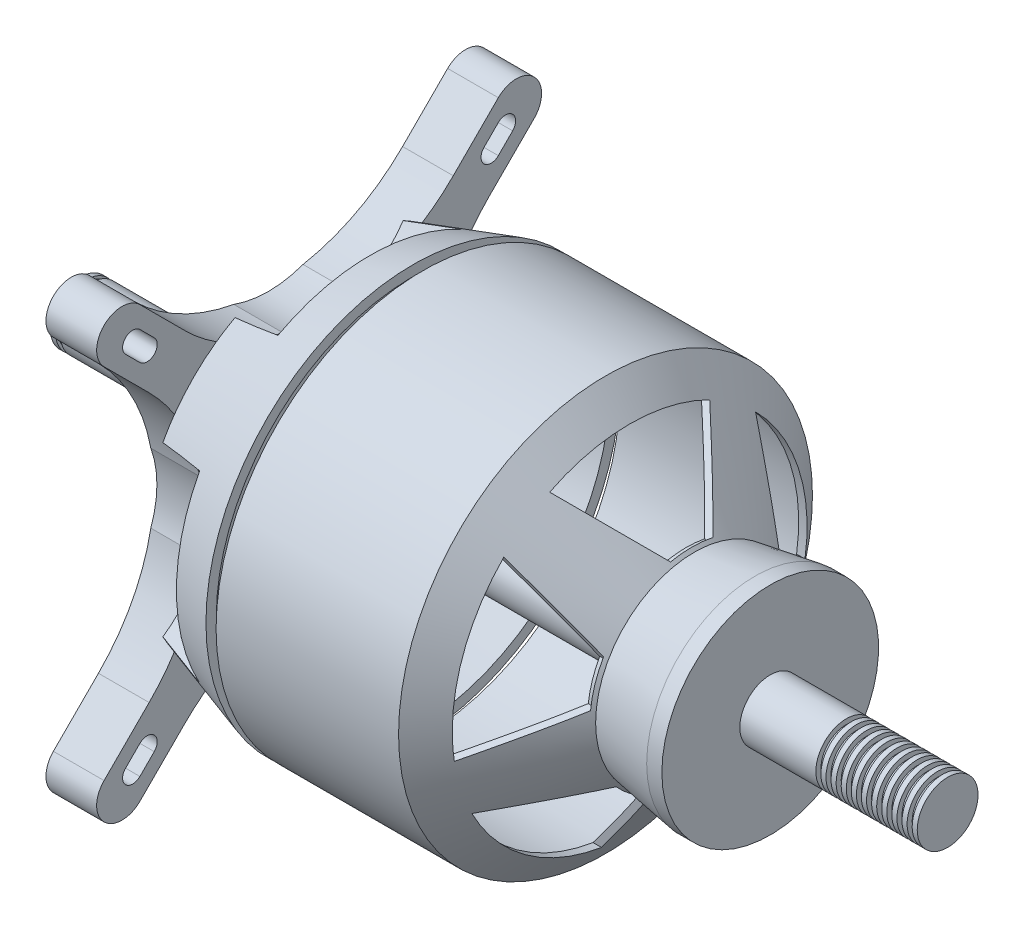
from build123d import *

# Parameters (mm, degrees)
SKETCH5_R           = 20
CUT_EXTRUDE1_DEPTH  = 10
CIRPATTERN2_COUNT   = 4
SKETCH6_R           = 6
BOSS_EXTRUDE3_DEPTH = 10
CUT_EXTRUDE2_DEPTH  = 10
CIRPATTERN3_COUNT   = 4
SKETCH8_R           = 2
CUT_EXTRUDE3_DEPTH  = 20
CIRPATTERN4_COUNT   = 4
CUT_EXTRUDE4_DEPTH  = 53
CIRPATTERN5_COUNT   = 5
SKETCH10_R          = 2.5
CUT_EXTRUDE5_DEPTH  = 20
CIRPATTERN6_COUNT   = 4


with BuildPart() as part:
    # Sketch1 → Revolve1 (revolve)
    with BuildSketch(Plane.XY, mode=Mode.PRIVATE) as revolve1_sk:
        Polygon((47, 6), (136, 6), (151, 6), (151, 5), (152, 5), (152, 6), (153, 6), (153, 5), (154, 5), (154, 6), (155, 6), (155, 5), (156, 5), (156, 6), (157, 6), (157, 5), (158, 5), (158, 6), (159, 6), (159, 5), (160, 5), (160, 6), (161, 6), (161, 5), (162, 5), (162, 6), (163, 6), (163, 5), (164, 5), (164, 6), (165, 6), (165, 5), (166, 5), (166, 6), (167, 6), (167, 5), (168, 5), (168, 6), (169, 6), (169, 5), (170, 5), (170, 6), (171, 6), (171, 0), (0, 0), (0, 6), (1, 6), (1, 5.5), (2, 5.5), (2, 6), align=None)
        Polygon((47, 35), (47, 6), (49.655465916, 6), (49.655465916, 33.855037011), (53.332972446, 35), (65.5, 38.788109179), (65.5, 38.83), (65.5, 40.83), align=None)
        Polygon((133, 19.45), (133, 6), (136, 6), (136, 21.38), (133, 21.38), (121, 19.45), (103.5, 40.83), (67.5, 40.83), (67.5, 38.83), (67.5, 38.788109179), (103.5, 38.788109179), (121, 17.497281901), align=None)
    revolve(revolve1_sk.sketch.rotate(Axis((0, 0, 0), (1, 0, 0)), 90), axis=Axis((0, 0, 0), (1, 0, 0)))

    # Sketch5 → Cut-Extrude1 (cut)
    with BuildSketch(Plane.ZY.offset(-47)):
        with Locations((0, 42)):
            Circle(SKETCH5_R)
    cut_extrude1 = extrude(amount=-CUT_EXTRUDE1_DEPTH, mode=Mode.SUBTRACT)

    # CirPattern2: Cut-Extrude1 ×4 about axis
    cirpattern2_axis = Axis((0, 0, 0), (1, 0, 0))
    for i in range(1, CIRPATTERN2_COUNT):
        add(cut_extrude1.rotate(cirpattern2_axis, i * 360 / CIRPATTERN2_COUNT), mode=Mode.SUBTRACT)

    # Sketch6 → Boss-Extrude3 (add)
    # profile 1 of 5: a face of its own
    with BuildSketch(Plane.ZY.offset(-47)):
        with BuildLine():
            ThreePointArc((-20.266309598, 28.535533906), (-24.748737342, 24.748737342), (-28.535533906, 20.266309598))
            ThreePointArc((-28.535533906, 20.266309598), (-25.213608865, 13.807350329), (-23.201779686, 6.828390223))
            ThreePointArc((-23.201779686, 6.828390223), (-22, 0), (-23.201779686, -6.828390223))
            ThreePointArc((-23.201779686, -6.828390223), (-25.213608865, -13.807350329), (-28.535533906, -20.266309598))
            ThreePointArc((-28.535533906, -20.266309598), (-24.748737342, -24.748737342), (-20.266309598, -28.535533906))
            ThreePointArc((-20.266309598, -28.535533906), (-13.807350329, -25.213608865), (-6.828390223, -23.201779686))
            ThreePointArc((-6.828390223, -23.201779686), (0, -22), (6.828390223, -23.201779686))
            ThreePointArc((6.828390223, -23.201779686), (13.807350329, -25.213608865), (20.266309598, -28.535533906))
            ThreePointArc((20.266309598, -28.535533906), (24.748737342, -24.748737342), (28.535533906, -20.266309598))
            ThreePointArc((28.535533906, -20.266309598), (25.213608865, -13.807350329), (23.201779686, -6.828390223))
            ThreePointArc((23.201779686, -6.828390223), (22, 0), (23.201779686, 6.828390223))
            ThreePointArc((23.201779686, 6.828390223), (25.213608865, 13.807350329), (28.535533906, 20.266309598))
            ThreePointArc((28.535533906, 20.266309598), (24.748737342, 24.748737342), (20.266309598, 28.535533906))
            ThreePointArc((20.266309598, 28.535533906), (13.807350329, 25.213608865), (6.828390223, 23.201779686))
            ThreePointArc((6.828390223, 23.201779686), (0, 22), (-6.828390223, 23.201779686))
            ThreePointArc((-6.828390223, 23.201779686), (-13.807350329, 25.213608865), (-20.266309598, 28.535533906))
        make_face()
        Circle(SKETCH6_R, mode=Mode.SUBTRACT)
    # profile 2 of 5: a face of its own
    with BuildSketch(Plane.ZY.offset(-47)):
        with BuildLine():
            ThreePointArc((-42.426406871, 42.426406871), (-43.890872965, 38.890872965), (-42.426406871, 35.355339059))
            Line((-42.426406871, 35.355339059), (-33.535533906, 26.464466094))
            ThreePointArc((-33.535533906, 26.464466094), (-30.870211431, 23.498752077), (-28.535533906, 20.266309598))
            ThreePointArc((-28.535533906, 20.266309598), (-24.748737342, 24.748737342), (-20.266309598, 28.535533906))
            ThreePointArc((-20.266309598, 28.535533906), (-23.498752077, 30.870211431), (-26.464466094, 33.535533906))
            Line((-26.464466094, 33.535533906), (-35.355339059, 42.426406871))
            ThreePointArc((-35.355339059, 42.426406871), (-38.890872965, 43.890872965), (-42.426406871, 42.426406871))
        make_face()
    # profile 3 of 5: a face of its own
    with BuildSketch(Plane.ZY.offset(-47)):
        with BuildLine():
            ThreePointArc((42.426406871, 35.355339059), (43.890872965, 38.890872965), (42.426406871, 42.426406871))
            ThreePointArc((42.426406871, 42.426406871), (38.890872965, 43.890872965), (35.355339059, 42.426406871))
            Line((35.355339059, 42.426406871), (26.464466094, 33.535533906))
            ThreePointArc((26.464466094, 33.535533906), (23.498752077, 30.870211431), (20.266309598, 28.535533906))
            ThreePointArc((20.266309598, 28.535533906), (24.748737342, 24.748737342), (28.535533906, 20.266309598))
            ThreePointArc((28.535533906, 20.266309598), (30.870211431, 23.498752077), (33.535533906, 26.464466094))
            Line((33.535533906, 26.464466094), (42.426406871, 35.355339059))
        make_face()
    # profile 4 of 5: a face of its own
    with BuildSketch(Plane.ZY.offset(-47)):
        with BuildLine():
            ThreePointArc((35.355339059, -42.426406871), (38.890872965, -43.890872965), (42.426406871, -42.426406871))
            ThreePointArc((42.426406871, -42.426406871), (43.890872965, -38.890872965), (42.426406871, -35.355339059))
            Line((42.426406871, -35.355339059), (33.535533906, -26.464466094))
            ThreePointArc((33.535533906, -26.464466094), (30.870211431, -23.498752077), (28.535533906, -20.266309598))
            ThreePointArc((28.535533906, -20.266309598), (24.748737342, -24.748737342), (20.266309598, -28.535533906))
            ThreePointArc((20.266309598, -28.535533906), (23.498752077, -30.870211431), (26.464466094, -33.535533906))
            Line((26.464466094, -33.535533906), (35.355339059, -42.426406871))
        make_face()
    # profile 5 of 5: a face of its own
    with BuildSketch(Plane.ZY.offset(-47)):
        with BuildLine():
            ThreePointArc((-42.426406871, -35.355339059), (-43.890872965, -38.890872965), (-42.426406871, -42.426406871))
            ThreePointArc((-42.426406871, -42.426406871), (-38.890872965, -43.890872965), (-35.355339059, -42.426406871))
            Line((-35.355339059, -42.426406871), (-26.464466094, -33.535533906))
            ThreePointArc((-26.464466094, -33.535533906), (-23.498752077, -30.870211431), (-20.266309598, -28.535533906))
            ThreePointArc((-20.266309598, -28.535533906), (-24.748737342, -24.748737342), (-28.535533906, -20.266309598))
            ThreePointArc((-28.535533906, -20.266309598), (-30.870211431, -23.498752077), (-33.535533906, -26.464466094))
            Line((-33.535533906, -26.464466094), (-42.426406871, -35.355339059))
        make_face()
    extrude(amount=BOSS_EXTRUDE3_DEPTH)

    # Sketch7 → Cut-Extrude2 (cut)
    with BuildSketch(Plane.ZY.offset(-37)):
        with BuildLine():
            ThreePointArc((-32.526911935, 35.355339059), (-32.526911935, 32.526911935), (-35.355339059, 32.526911935))
            Line((-35.355339059, 32.526911935), (-38.183766184, 35.355339059))
            ThreePointArc((-38.183766184, 35.355339059), (-38.183766184, 38.183766184), (-35.355339059, 38.183766184))
            Line((-35.355339059, 38.183766184), (-32.526911935, 35.355339059))
        make_face()
    cut_extrude2 = extrude(amount=-CUT_EXTRUDE2_DEPTH, mode=Mode.SUBTRACT)

    # CirPattern3: Cut-Extrude2 ×4 about axis
    cirpattern3_axis = Axis((0, 0, 0), (1, 0, 0))
    for i in range(1, CIRPATTERN3_COUNT):
        add(cut_extrude2.rotate(cirpattern3_axis, i * 360 / CIRPATTERN3_COUNT), mode=Mode.SUBTRACT)

    # Sketch8 → Cut-Extrude3 (cut)
    with BuildSketch(Plane.ZY.offset(-37)):
        with Locations((20.529961225, 21.184208555)):
            Circle(SKETCH8_R)
    cut_extrude3 = extrude(amount=-CUT_EXTRUDE3_DEPTH, mode=Mode.SUBTRACT)

    # CirPattern4: Cut-Extrude3 ×4 about axis
    cirpattern4_axis = Axis((0, 0, 0), (1, 0, 0))
    for i in range(1, CIRPATTERN4_COUNT):
        add(cut_extrude3.rotate(cirpattern4_axis, i * 360 / CIRPATTERN4_COUNT), mode=Mode.SUBTRACT)

    # Sketch9 → Cut-Extrude4 (cut)
    with BuildSketch(Plane.ZY.offset(-67.5)):
        with BuildLine():
            Line((-15.787217569, 31.237217569), (-4, 19.45))
            Line((-4, 19.45), (-3.65373565, 19.10373565))
            ThreePointArc((-3.65373565, 19.10373565), (0, 19.45), (3.65373565, 19.10373565))
            Line((3.65373565, 19.10373565), (4, 19.45))
            Line((4, 19.45), (15.787217569, 31.237217569))
            ThreePointArc((15.787217569, 31.237217569), (0, 35), (-15.787217569, 31.237217569))
        make_face()
    cut_extrude4 = extrude(amount=-CUT_EXTRUDE4_DEPTH, mode=Mode.SUBTRACT)

    # CirPattern5: Cut-Extrude4 ×5 about axis
    cirpattern5_axis = Axis((0, 0, 0), (-1, 0, 0))
    for i in range(1, CIRPATTERN5_COUNT):
        add(cut_extrude4.rotate(cirpattern5_axis, i * 360 / CIRPATTERN5_COUNT), mode=Mode.SUBTRACT)

    # Sketch10 → Cut-Extrude5 (cut)
    with BuildSketch(Plane.ZY.offset(-37)):
        with Locations((-21.184208555, 20.529961225)):
            Circle(SKETCH10_R)
    cut_extrude5 = extrude(amount=-CUT_EXTRUDE5_DEPTH, mode=Mode.SUBTRACT)

    # CirPattern6: Cut-Extrude5 ×4 about axis
    cirpattern6_axis = Axis((0, 0, 0), (1, 0, 0))
    for i in range(1, CIRPATTERN6_COUNT):
        add(cut_extrude5.rotate(cirpattern6_axis, i * 360 / CIRPATTERN6_COUNT), mode=Mode.SUBTRACT)


solid = part.part
